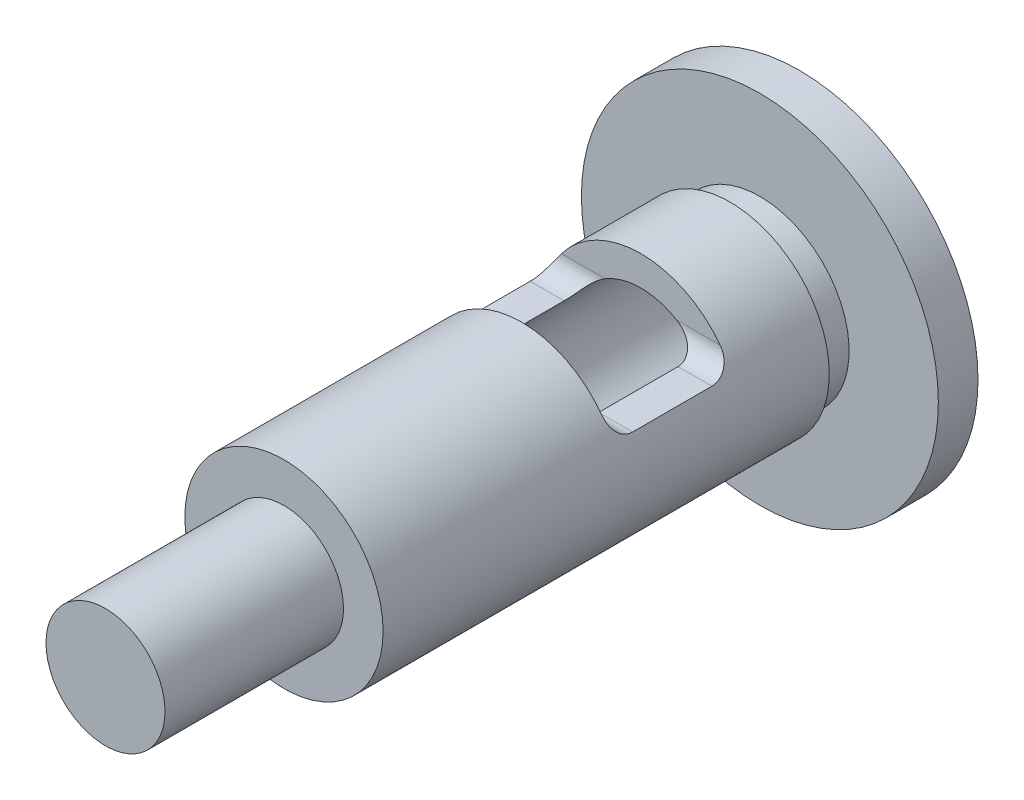
from build123d import *

# Parameters (mm, degrees)
ENL_V_MAT_EXTRU_1_DEPTH      = 10
ENL_V_MAT_EXTRU_1_DEPTH_BACK = 10


with BuildPart() as part:
    # Esquisse1 → Révolution1 (revolve)
    with BuildSketch(Plane(origin=(0, 0, 0), x_dir=(0, 0, -1), z_dir=(1, 0, 0))):
        Polygon((-70, 0), (-36, 0), (-32, 7), (0, 7), (0, 18), (-4, 18), (-4, 9), (-7, 9), (-7, 10), (-52, 10), (-52, 6), (-70, 6), align=None)
    revolve(axis=Axis((0, 0, 0), (0, 0, 1)))

    # Esquisse2 → Enlèv. mat.-Extru.1 (cut, two sides: drawn at the far end of the back side and taken through both)
    with BuildSketch(Plane(origin=(0, 0, 0), x_dir=(0, 0, -1), z_dir=(1, 0, 0)).offset(-ENL_V_MAT_EXTRU_1_DEPTH_BACK)):
        with BuildLine():
            Line((-16, 10), (-28, 10))
            Line((-28, 10), (-28, 6))
            ThreePointArc((-28, 6), (-27.414213562, 4.585786438), (-26, 4))
            Line((-26, 4), (-18, 4))
            ThreePointArc((-18, 4), (-16.585786438, 4.585786438), (-16, 6))
            Line((-16, 6), (-16, 10))
        make_face()
    extrude(amount=ENL_V_MAT_EXTRU_1_DEPTH + ENL_V_MAT_EXTRU_1_DEPTH_BACK, mode=Mode.SUBTRACT)


solid = part.part
